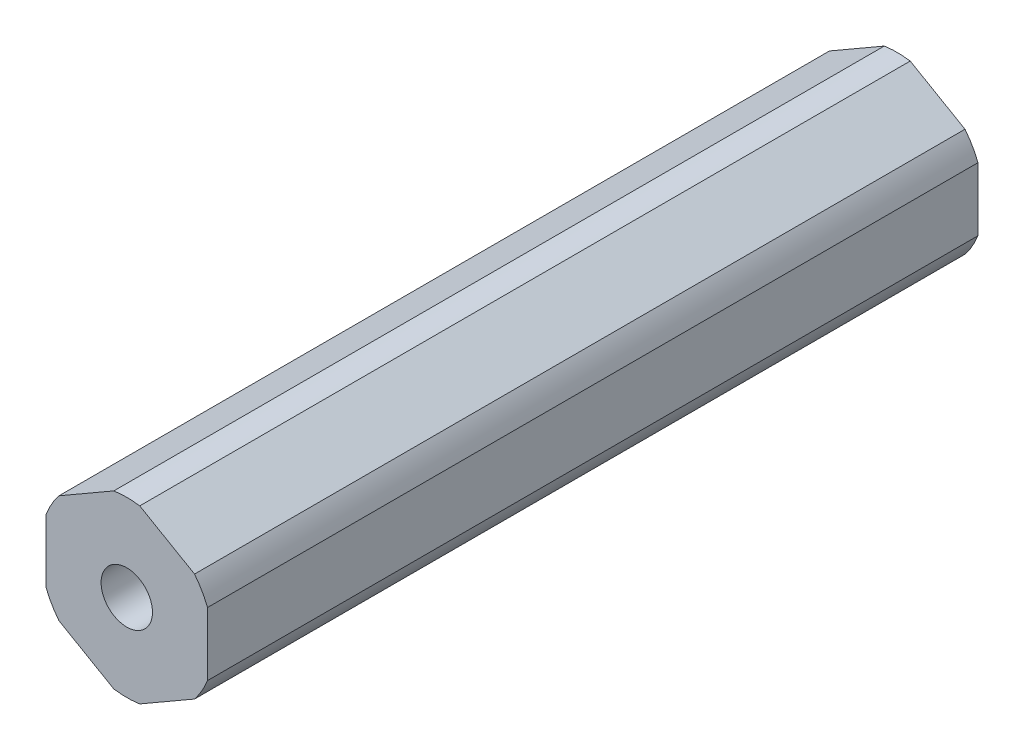
from build123d import *

# Parameters (mm, degrees)
BOSS_EXTRUDE1_DEPTH        = 30.2895
F_10_32_TAPPED_HOLE1_D     = 4.0386
F_10_32_TAPPED_HOLE1_DEPTH = 12.02944
F_10_32_TAPPED_HOLE1_TIP   = 1.213317848
F_10_32_TAPPED_HOLE2_D     = 4.0386
F_10_32_TAPPED_HOLE2_DEPTH = 12.02944
F_10_32_TAPPED_HOLE2_TIP   = 1.213317848


with BuildPart() as part:
    # Sketch1 → Boss-Extrude1 (new, symmetric)
    with BuildSketch(Plane.XY):
        with BuildLine():
            ThreePointArc((6.35, 2.48767683), (5.906206651, 3.40995), (5.329391331, 4.255422899))
            Line((5.329391331, 4.255422899), (1.020608669, 6.743099729))
            ThreePointArc((1.020608669, 6.743099729), (0, 6.8199), (-1.020608669, 6.743099729))
            Line((-1.020608669, 6.743099729), (-5.329391331, 4.255422899))
            ThreePointArc((-5.329391331, 4.255422899), (-5.906206651, 3.40995), (-6.35, 2.48767683))
            Line((-6.35, 2.48767683), (-6.35, -2.48767683))
            ThreePointArc((-6.35, -2.48767683), (-5.906206651, -3.40995), (-5.329391331, -4.255422899))
            Line((-5.329391331, -4.255422899), (-1.020608669, -6.743099729))
            ThreePointArc((-1.020608669, -6.743099729), (0, -6.8199), (1.020608669, -6.743099729))
            Line((1.020608669, -6.743099729), (5.329391331, -4.255422899))
            ThreePointArc((5.329391331, -4.255422899), (5.906206651, -3.40995), (6.35, -2.48767683))
            Line((6.35, -2.48767683), (6.35, 2.48767683))
        make_face()
    extrude(amount=BOSS_EXTRUDE1_DEPTH, both=True)

    # #10-32 Tapped Hole1
    with Locations(Plane.XY.offset(30.2895)):
        with Locations((0, 0)):
            Hole(F_10_32_TAPPED_HOLE1_D / 2, depth=F_10_32_TAPPED_HOLE1_DEPTH)
            with Locations((0, 0, -(F_10_32_TAPPED_HOLE1_DEPTH + F_10_32_TAPPED_HOLE1_TIP / 2))):  # 118° drill point
                Cone(0, F_10_32_TAPPED_HOLE1_D / 2, F_10_32_TAPPED_HOLE1_TIP, mode=Mode.SUBTRACT)

    # #10-32 Tapped Hole2
    with Locations(Plane(origin=(0, 0, -30.2895), x_dir=(-1, 0, 0), z_dir=(0, 0, -1))):
        with Locations((0, 0)):
            Hole(F_10_32_TAPPED_HOLE2_D / 2, depth=F_10_32_TAPPED_HOLE2_DEPTH)
            with Locations((0, 0, -(F_10_32_TAPPED_HOLE2_DEPTH + F_10_32_TAPPED_HOLE2_TIP / 2))):  # 118° drill point
                Cone(0, F_10_32_TAPPED_HOLE2_D / 2, F_10_32_TAPPED_HOLE2_TIP, mode=Mode.SUBTRACT)


solid = part.part
